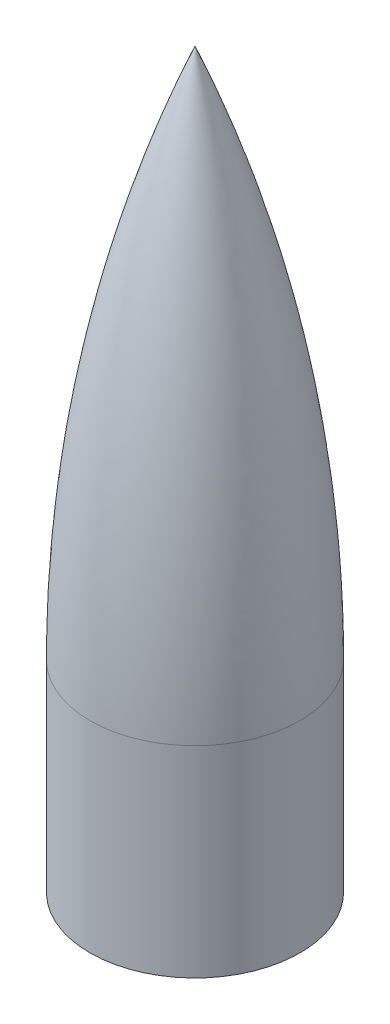
from build123d import *

# Parameters (mm, degrees)
BOSS_EXTRUDE1_REACH = 566.43
SKETCH5_R           = 78.35


with BuildPart() as part:
    # Sketch1 → Revolve3 (revolve)
    with BuildSketch(Plane.XY, mode=Mode.PRIVATE) as revolve3_sk:
        with BuildLine():
            Line((0, 400), (0, 402.756656622))
            ThreePointArc((0, 402.756656622), (60.363605816, 205.385909299), (80.75, 0))
            Line((80.75, 0), (80.75, -150))
            Line((80.75, -150), (78.35, -150))
            Line((78.35, -150), (78.35, 0))
            ThreePointArc((78.35, 0), (58.574924408, 202.078213736), (0, 396.489212171))
            Line((0, 396.489212171), (0, 400))
        make_face()
    revolve(revolve3_sk.sketch.rotate(Axis((0, 400, 0), (0, 1, 0)), 270), axis=Axis((0, 400, 0), (0, 1, 0)))


with BuildPart() as body_2:

    # Sketch5 → Boss-Extrude1 (new, up to next)
    with BuildSketch(Plane.XZ.offset(150), mode=Mode.PRIVATE) as boss_extrude1_sk1:
        with Locations(Location((0, 0, 0), (0, 0, 270))):
            Circle(SKETCH5_R)
    boss_extrude1_tool1 = extrude(boss_extrude1_sk1.sketch, amount=-BOSS_EXTRUDE1_REACH, mode=Mode.PRIVATE) - part.part
    add(boss_extrude1_tool1.solids().sort_by_distance((0, -150, 0))[0])


solid = body_2.part
